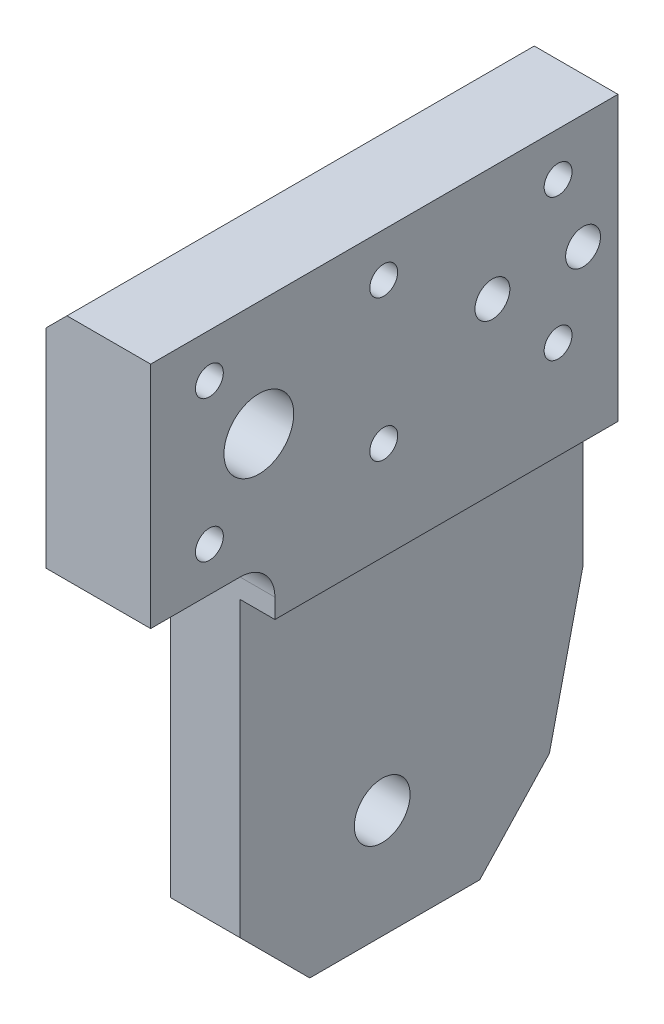
from build123d import *

# Parameters (mm, degrees)
SKETCH_1_R                    = 4
EXTRUDE_1_DEPTH               = 15
SKETCH_2_W                    = 6.467517269
SKETCH_2_H                    = 62.62553055
CUT_EXTRUDE_1_DEPTH           = 55
SKETCH_3_R                    = 5
SKETCH_3_R_2                  = 2.5
CUT_EXTRUDE_2_DEPTH           = 103.877774352
CHAMFER_1_SIZE                = 10
CHAMFER_2_SIZE                = 11
CHAMFER_2_SIZE2               = 7.519269615
FILLET_1_R                    = 5
SKETCH_4_R                    = 2
CUT_EXTRUDE_3_DEPTH           = 103.877774352
SKETCH_5_R                    = 3
CUT_EXTRUDE_4_DEPTH           = 1.5
CUT_EXTRUDE_4_DRAFT           = -33
CUT_EXTRUDE_4_PROFILE_2_DEPTH = 1.5
CUT_EXTRUDE_4_PROFILE_2_DRAFT = -33
CUT_EXTRUDE_4_PROFILE_3_DEPTH = 1.5
CUT_EXTRUDE_4_PROFILE_3_DRAFT = -33
CUT_EXTRUDE_4_PROFILE_4_DEPTH = 1.5
CUT_EXTRUDE_4_PROFILE_4_DRAFT = -33
CUT_EXTRUDE_4_PROFILE_5_DEPTH = 1.5
CUT_EXTRUDE_4_PROFILE_5_DRAFT = -33
CUT_EXTRUDE_4_PROFILE_6_DEPTH = 1.5
CUT_EXTRUDE_4_PROFILE_6_DRAFT = -33
CHAMFER_3_SIZE                = 3


with BuildPart() as part:
    # Эскиз1 → Вытянуть1 (new body)
    with BuildSketch(Plane(origin=(0, 0, 0), x_dir=(0, 0, -1), z_dir=(1, 0, 0))):
        Polygon((-24.418434976, -32.650020726), (-6.60217121, -32.650020726), (-6.60217121, -92.442667507), (35.288487723, -92.442667507), (42.581565024, -60.831663771), (42.581565024, 0.195067042), (-24.418434965, 0.195067042), align=None)
        with Locations((13.784244497, -76.834002497)):
            Circle(SKETCH_1_R, mode=Mode.SUBTRACT)
    extrude(amount=-EXTRUDE_1_DEPTH)

    # Эскиз2 → Вырез-Вытянуть1 (cut, symmetric)
    with BuildSketch(Plane.XY):
        with Locations((-1.770599523, -71.740194192)):
            Rectangle(SKETCH_2_W, SKETCH_2_H)
    extrude(amount=CUT_EXTRUDE_1_DEPTH, both=True, mode=Mode.SUBTRACT)

    # Эскиз3 → Вырез-Вытянуть2 (cut, through all)
    with BuildSketch(Plane.ZY.offset(15)):
        with Locations((8.904690385, -16.227476847)):
            Circle(SKETCH_3_R)
        with Locations((-37.581565054, -16.227476862)):
            Circle(SKETCH_3_R_2)
        with Locations((-24.581565054, -16.227476862)):
            Circle(SKETCH_3_R_2)
    extrude(amount=-CUT_EXTRUDE_2_DEPTH, mode=Mode.SUBTRACT)

    # Фаска1
    chamfer_1_edges = [part.edges().sort_by_distance(p)[0] for p in [
        (-10.002179078, -92.442667507, 6.60217121),
    ]]
    chamfer(chamfer_1_edges, length=CHAMFER_1_SIZE)

    # Фаска2
    chamfer_2_edges = [part.edges().sort_by_distance(p)[0] for p in [
        (-10.002179078, -92.442667507, -35.288487723),
    ]]
    chamfer_2_side = [part.faces().sort_by_distance(p)[0] for p in [
        (-10.002179078, -76.637165639, -38.935026373),
    ]]
    chamfer(chamfer_2_edges, length=CHAMFER_2_SIZE, length2=CHAMFER_2_SIZE2, reference=chamfer_2_side[0])

    # Скругление1
    fillet_1_edges = [part.edges().sort_by_distance(p)[0] for p in [
        (-7.5, -32.650020726, 6.60217121),
    ]]
    fillet(fillet_1_edges, radius=FILLET_1_R)

    # Эскиз4 → Вырез-Вытянуть3 (cut, through all)
    with BuildSketch(Plane.ZY.offset(15)):
        with Locations((-34, -6.080814008)):
            Circle(SKETCH_4_R)
        with Locations((-9, -6.080814008)):
            Circle(SKETCH_4_R)
        with Locations((16, -6.080814008)):
            Circle(SKETCH_4_R)
        with Locations(Location((16, -26.374139717, 0), (0, 0, 180))):
            Circle(SKETCH_4_R)
        with Locations(Location((-9, -26.374139717, 0), (0, 0, 180))):
            Circle(SKETCH_4_R)
        with Locations(Location((-34, -26.374139717, 0), (0, 0, 180))):
            Circle(SKETCH_4_R)
    extrude(amount=-CUT_EXTRUDE_3_DEPTH, mode=Mode.SUBTRACT)


with BuildPart() as cut_extrude_4_tool:
    # Эскиз5 → Вырез-Вытянуть4 (with draft: the straight prism first)
    with BuildSketch(Plane.ZY.offset(15)):
        with Locations((-34, -6.080814008)):
            Circle(SKETCH_5_R)
    extrude(amount=-CUT_EXTRUDE_4_DEPTH)
    # Вырез-Вытянуть4: the draft: its side faces are tilted about the plane it starts from
    cut_extrude_4_sides = [cut_extrude_4_tool.faces().sort_by_distance(p)[0] for p in [
        (-14.25, -6.080814008, -37),
    ]]
    draft(cut_extrude_4_sides, Plane.ZY.offset(15), CUT_EXTRUDE_4_DRAFT)


with BuildPart() as part_1:
    add(part.part)

    # Вырез-Вытянуть4: cut by cut_extrude_4_tool
    add(cut_extrude_4_tool.part, mode=Mode.SUBTRACT)


with BuildPart() as cut_extrude_4_profile_2_tool:
    # Эскиз5 → Вырез-Вытянуть4 profile 2 (with draft: the straight prism first)
    with BuildSketch(Plane.ZY.offset(15)):
        with Locations((-9, -6.080814008)):
            Circle(SKETCH_5_R)
    extrude(amount=-CUT_EXTRUDE_4_PROFILE_2_DEPTH)
    # Вырез-Вытянуть4 profile 2: the draft: its side faces are tilted about the plane it starts from
    cut_extrude_4_profile_2_sides = [cut_extrude_4_profile_2_tool.faces().sort_by_distance(p)[0] for p in [
        (-14.25, -6.080814008, -12),
    ]]
    draft(cut_extrude_4_profile_2_sides, Plane.ZY.offset(15), CUT_EXTRUDE_4_PROFILE_2_DRAFT)


with BuildPart() as part_2:
    add(part_1.part)

    # Вырез-Вытянуть4 profile 2: cut by cut_extrude_4_profile_2_tool
    add(cut_extrude_4_profile_2_tool.part, mode=Mode.SUBTRACT)


with BuildPart() as cut_extrude_4_profile_3_tool:
    # Эскиз5 → Вырез-Вытянуть4 profile 3 (with draft: the straight prism first)
    with BuildSketch(Plane.ZY.offset(15)):
        with Locations((16, -6.080814008)):
            Circle(SKETCH_5_R)
    extrude(amount=-CUT_EXTRUDE_4_PROFILE_3_DEPTH)
    # Вырез-Вытянуть4 profile 3: the draft: its side faces are tilted about the plane it starts from
    cut_extrude_4_profile_3_sides = [cut_extrude_4_profile_3_tool.faces().sort_by_distance(p)[0] for p in [
        (-14.25, -6.080814008, 13),
    ]]
    draft(cut_extrude_4_profile_3_sides, Plane.ZY.offset(15), CUT_EXTRUDE_4_PROFILE_3_DRAFT)


with BuildPart() as part_3:
    add(part_2.part)

    # Вырез-Вытянуть4 profile 3: cut by cut_extrude_4_profile_3_tool
    add(cut_extrude_4_profile_3_tool.part, mode=Mode.SUBTRACT)


with BuildPart() as cut_extrude_4_profile_4_tool:
    # Эскиз5 → Вырез-Вытянуть4 profile 4 (with draft: the straight prism first)
    with BuildSketch(Plane.ZY.offset(15)):
        with Locations((16, -26.374139717)):
            Circle(SKETCH_5_R)
    extrude(amount=-CUT_EXTRUDE_4_PROFILE_4_DEPTH)
    # Вырез-Вытянуть4 profile 4: the draft: its side faces are tilted about the plane it starts from
    cut_extrude_4_profile_4_sides = [cut_extrude_4_profile_4_tool.faces().sort_by_distance(p)[0] for p in [
        (-14.25, -26.374139717, 13),
    ]]
    draft(cut_extrude_4_profile_4_sides, Plane.ZY.offset(15), CUT_EXTRUDE_4_PROFILE_4_DRAFT)


with BuildPart() as part_4:
    add(part_3.part)

    # Вырез-Вытянуть4 profile 4: cut by cut_extrude_4_profile_4_tool
    add(cut_extrude_4_profile_4_tool.part, mode=Mode.SUBTRACT)


with BuildPart() as cut_extrude_4_profile_5_tool:
    # Эскиз5 → Вырез-Вытянуть4 profile 5 (with draft: the straight prism first)
    with BuildSketch(Plane.ZY.offset(15)):
        with Locations((-9, -26.374139717)):
            Circle(SKETCH_5_R)
    extrude(amount=-CUT_EXTRUDE_4_PROFILE_5_DEPTH)
    # Вырез-Вытянуть4 profile 5: the draft: its side faces are tilted about the plane it starts from
    cut_extrude_4_profile_5_sides = [cut_extrude_4_profile_5_tool.faces().sort_by_distance(p)[0] for p in [
        (-14.25, -26.374139717, -12),
    ]]
    draft(cut_extrude_4_profile_5_sides, Plane.ZY.offset(15), CUT_EXTRUDE_4_PROFILE_5_DRAFT)


with BuildPart() as part_5:
    add(part_4.part)

    # Вырез-Вытянуть4 profile 5: cut by cut_extrude_4_profile_5_tool
    add(cut_extrude_4_profile_5_tool.part, mode=Mode.SUBTRACT)


with BuildPart() as cut_extrude_4_profile_6_tool:
    # Эскиз5 → Вырез-Вытянуть4 profile 6 (with draft: the straight prism first)
    with BuildSketch(Plane.ZY.offset(15)):
        with Locations((-34, -26.374139717)):
            Circle(SKETCH_5_R)
    extrude(amount=-CUT_EXTRUDE_4_PROFILE_6_DEPTH)
    # Вырез-Вытянуть4 profile 6: the draft: its side faces are tilted about the plane it starts from
    cut_extrude_4_profile_6_sides = [cut_extrude_4_profile_6_tool.faces().sort_by_distance(p)[0] for p in [
        (-14.25, -26.374139717, -37),
    ]]
    draft(cut_extrude_4_profile_6_sides, Plane.ZY.offset(15), CUT_EXTRUDE_4_PROFILE_6_DRAFT)


with BuildPart() as part_6:
    add(part_5.part)

    # Вырез-Вытянуть4 profile 6: cut by cut_extrude_4_profile_6_tool
    add(cut_extrude_4_profile_6_tool.part, mode=Mode.SUBTRACT)

    # Фаска3
    chamfer_3_edges = [part_6.edges().sort_by_distance(p)[0] for p in [
        (-15, 0.195067042, -9.08156503),
    ]]
    chamfer(chamfer_3_edges, length=CHAMFER_3_SIZE)


solid = part_6.part
